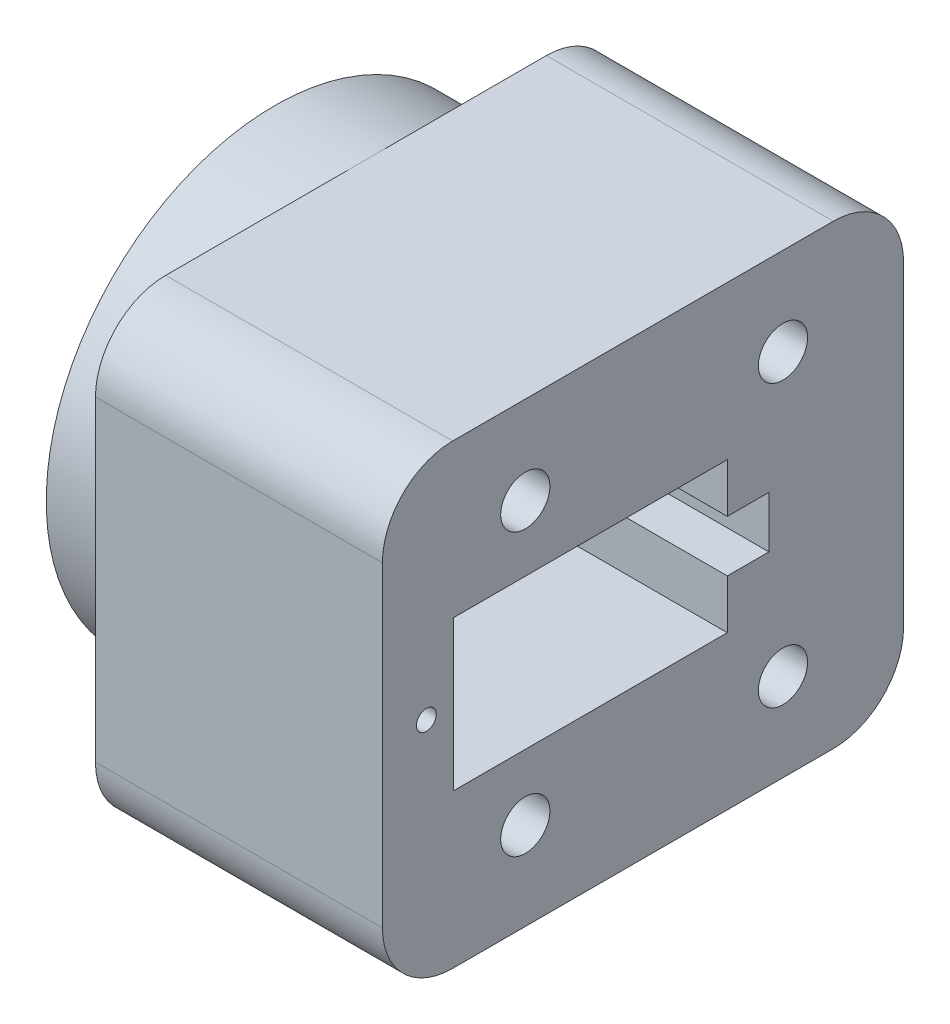
from build123d import *

# Parameters (mm, degrees)
SKETCH1_W           = 40.7
SKETCH1_H           = 17
BOSS_EXTRUDE1_DEPTH = 24.5
SKETCH2_W           = 40.7
SKETCH2_H           = 34
BOSS_EXTRUDE2_DEPTH = 4
SKETCH3_R           = 3.6
CUT_EXTRUDE1_DEPTH  = 4.4
CUT_EXTRUDE2_DEPTH  = 4.4
SKETCH5_R           = 1.2
CUT_EXTRUDE3_DEPTH  = 7
SKETCH6_W           = 23.4
SKETCH6_H           = 12.8
CUT_EXTRUDE4_DEPTH  = 19.2
SKETCH7_W           = 3.7
SKETCH7_H           = 4.4
CUT_EXTRUDE5_DEPTH  = 16
SKETCH8_R           = 0.85
CUT_EXTRUDE6_DEPTH  = 8.6
SKETCH9_R           = 1.7
CUT_EXTRUDE7_DEPTH  = 4.7
SKETCH10_W          = 5.5
SKETCH10_H          = 4.4
CUT_EXTRUDE8_DEPTH  = 8.3
BOSS_EXTRUDE3_DEPTH = 24.5
SKETCH12_W          = 5.5
SKETCH12_H          = 4.4
CUT_EXTRUDE9_DEPTH  = 3.5
CUT_EXTRUDE10_DEPTH = 326.708673511
SKETCH14_R          = 19.5
SKETCH14_R_2        = 18.3
BOSS_EXTRUDE4_DEPTH = 7.9
SKETCH15_R          = 2.1
CUT_EXTRUDE11_DEPTH = 6.1
SKETCH16_R          = 18.3
SKETCH16_R_2        = 17.7
BOSS_EXTRUDE6_DEPTH = 6


with BuildPart() as part:
    # Sketch1 → Boss-Extrude1 (new body)
    with BuildSketch(Plane(origin=(169.4, 0, 0), x_dir=(0, 0, -1), z_dir=(1, 0, 0))):
        with Locations((-303.85, 0)):
            Rectangle(SKETCH1_W, SKETCH1_H)
    extrude(amount=BOSS_EXTRUDE1_DEPTH)

    # Sketch2 → Boss-Extrude2 (add)
    with BuildSketch(Plane(origin=(189.9, 0, 0), x_dir=(0, 0, -1), z_dir=(1, 0, 0))):
        with Locations((-303.85, 0)):
            Rectangle(SKETCH2_W, SKETCH2_H)
    extrude(amount=BOSS_EXTRUDE2_DEPTH)

    # Sketch3 → Cut-Extrude1 (cut)
    with BuildSketch(Plane(origin=(169.4, 0, 0), x_dir=(0, 0, -1), z_dir=(1, 0, 0))):
        with Locations((-301, 0)):
            Circle(SKETCH3_R)
    extrude(amount=CUT_EXTRUDE1_DEPTH, mode=Mode.SUBTRACT)

    # Sketch4 → Cut-Extrude2 (cut)
    with BuildSketch(Plane(origin=(169.4, 0, 0), x_dir=(0, 0, -1), z_dir=(1, 0, 0))):
        Polygon((-285.15, -1.95), (-301, -2.8), (-316.85, -1.95), (-316.85, 1.95), (-301, 2.8), (-285.15, 1.95), align=None)
    extrude(amount=CUT_EXTRUDE2_DEPTH, mode=Mode.SUBTRACT)

    # Sketch5 → Cut-Extrude3 (cut)
    with BuildSketch(Plane(origin=(169.4, 0, 0), x_dir=(0, 0, -1), z_dir=(1, 0, 0))):
        with Locations((-301, 0)):
            Circle(SKETCH5_R)
    extrude(amount=CUT_EXTRUDE3_DEPTH, mode=Mode.SUBTRACT)

    # Sketch6 → Cut-Extrude4 (cut)
    with BuildSketch(Plane(origin=(194.5, 0, 0), x_dir=(0, 0, -1), z_dir=(1, 0, 0))):
        with Locations((-306.45, 0)):
            Rectangle(SKETCH6_W, SKETCH6_H)
    extrude(amount=-CUT_EXTRUDE4_DEPTH, mode=Mode.SUBTRACT)

    # Sketch7 → Cut-Extrude5 (cut)
    with BuildSketch(Plane(origin=(194.5, 0, 0), x_dir=(0, 0, -1), z_dir=(1, 0, 0))):
        with Locations((-293.05, 0)):
            Rectangle(SKETCH7_W, SKETCH7_H)
    extrude(amount=-CUT_EXTRUDE5_DEPTH, mode=Mode.SUBTRACT)

    # Sketch8 → Cut-Extrude6 (cut)
    with BuildSketch(Plane(origin=(194.5, 0, 0), x_dir=(0, 0, -1), z_dir=(1, 0, 0))):
        with Locations((-320.45, 0)):
            Circle(SKETCH8_R)
    extrude(amount=-CUT_EXTRUDE6_DEPTH, mode=Mode.SUBTRACT)

    # Sketch9 → Cut-Extrude7 (cut)
    with BuildSketch(Plane(origin=(194.5, 0, 0), x_dir=(0, 0, -1), z_dir=(1, 0, 0))):
        with Locations(Location((-290, 12, 0), (0, 0, 180))):
            Circle(SKETCH9_R)
        with Locations(Location((-290, -12, 0), (0, 0, 180))):
            Circle(SKETCH9_R)
        with Locations(Location((-312, 12, 0), (0, 0, 180))):
            Circle(SKETCH9_R)
        with Locations(Location((-312, -12, 0), (0, 0, 180))):
            Circle(SKETCH9_R)
    extrude(amount=-CUT_EXTRUDE7_DEPTH, mode=Mode.SUBTRACT)

    # Sketch10 → Cut-Extrude8 (cut)
    with BuildSketch(Plane.XY.offset(283)):
        with Locations((181.25, 0)):
            Rectangle(SKETCH10_W, SKETCH10_H)
    extrude(amount=CUT_EXTRUDE8_DEPTH, mode=Mode.SUBTRACT)

    # Sketch11 → Boss-Extrude3 (add)
    with BuildSketch(Plane(origin=(169.4, 0, 0), x_dir=(0, 0, -1), z_dir=(1, 0, 0))):
        Polygon((-279.7, -19.5), (-324.2, -19.5), (-324.2, -8.5), (-283.5, -8.5), (-283.5, 8.5), (-324.2, 8.5), (-324.2, 19.5), (-279.7, 19.5), align=None)
    extrude(amount=BOSS_EXTRUDE3_DEPTH)

    # Sketch12 → Cut-Extrude9 (cut, symmetric)
    with BuildSketch(Plane.XY.offset(283)):
        with Locations((181.25, 0)):
            Rectangle(SKETCH12_W, SKETCH12_H)
    extrude(amount=CUT_EXTRUDE9_DEPTH, both=True, mode=Mode.SUBTRACT)

    # Sketch13 → Cut-Extrude10 (cut, through all)
    with BuildSketch(Plane(origin=(169.4, 0, 0), x_dir=(0, 0, -1), z_dir=(1, 0, 0))):
        with BuildLine():
            Line((-324.2, 13.5), (-325.5, 13.5))
            Line((-325.5, 13.5), (-325.5, 20.5))
            Line((-325.5, 20.5), (-318.2, 20.5))
            Line((-318.2, 20.5), (-318.2, 19.5))
            ThreePointArc((-318.2, 19.5), (-322.442640687, 17.742640687), (-324.2, 13.5))
        make_face()
        with BuildLine():
            Line((-324.2, -13.5), (-325.5, -13.5))
            Line((-325.5, -13.5), (-325.5, -20.5))
            Line((-325.5, -20.5), (-318.2, -20.5))
            Line((-318.2, -20.5), (-318.2, -19.5))
            ThreePointArc((-318.2, -19.5), (-322.442640687, -17.742640687), (-324.2, -13.5))
        make_face()
        with BuildLine():
            Line((-279.7, 13.5), (-278.4, 13.5))
            Line((-278.4, 13.5), (-278.4, 20.5))
            Line((-278.4, 20.5), (-285.7, 20.5))
            Line((-285.7, 20.5), (-285.7, 19.5))
            ThreePointArc((-285.7, 19.5), (-281.457359313, 17.742640687), (-279.7, 13.5))
        make_face()
        with BuildLine():
            Line((-279.7, -13.5), (-278.4, -13.5))
            Line((-278.4, -13.5), (-278.4, -20.5))
            Line((-278.4, -20.5), (-285.7, -20.5))
            Line((-285.7, -20.5), (-285.7, -19.5))
            ThreePointArc((-285.7, -19.5), (-281.457359313, -17.742640687), (-279.7, -13.5))
        make_face()
    extrude(amount=CUT_EXTRUDE10_DEPTH, mode=Mode.SUBTRACT)

    # Sketch14 → Boss-Extrude4 (add)
    with BuildSketch(Plane(origin=(169.4, 0, 0), x_dir=(0, 0, -1), z_dir=(1, 0, 0))):
        with Locations((-301, 0)):
            Circle(SKETCH14_R)
        with Locations((-301, 0)):
            Circle(SKETCH14_R_2, mode=Mode.SUBTRACT)
    extrude(amount=-BOSS_EXTRUDE4_DEPTH)

    # Sketch15 → Cut-Extrude11 (cut)
    with BuildSketch(Plane(origin=(194.5, 0, 0), x_dir=(0, 0, -1), z_dir=(1, 0, 0))):
        with Locations((-290, 12)):
            Circle(SKETCH15_R)
        with Locations((-290, -12)):
            Circle(SKETCH15_R)
        with Locations((-312, 12)):
            Circle(SKETCH15_R)
        with Locations((-312, -12)):
            Circle(SKETCH15_R)
    extrude(amount=-CUT_EXTRUDE11_DEPTH, mode=Mode.SUBTRACT)

    # Sketch16 → Boss-Extrude6 (add)
    with BuildSketch(Plane(origin=(169.4, 0, 0), x_dir=(0, 0, -1), z_dir=(1, 0, 0))):
        with Locations((-301, 0)):
            Circle(SKETCH16_R)
        with Locations((-301, 0)):
            Circle(SKETCH16_R_2, mode=Mode.SUBTRACT)
    extrude(amount=-BOSS_EXTRUDE6_DEPTH)


solid = part.part
